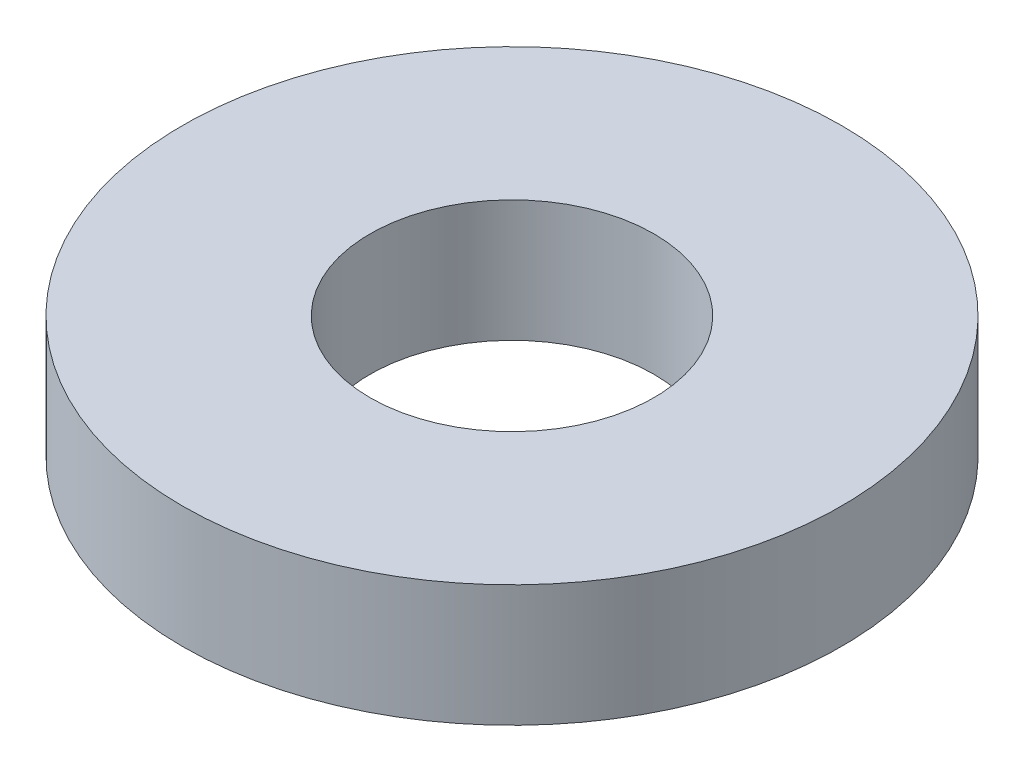
from build123d import *

# Parameters (mm, degrees)
SKETCH_1_R      = 32.5
SKETCH_1_R_2    = 14
EXTRUDE_1_DEPTH = 12


with BuildPart() as part:
    # 草图1 → 凸台-拉伸1 (new body)
    with BuildSketch(Plane(origin=(0, 0, 0), x_dir=(1, 0, 0), z_dir=(0, 1, 0))):
        with Locations(Location((0, 0, 0), (0, 0, 270))):
            Circle(SKETCH_1_R)
        with Locations(Location((0, 0, 0), (0, 0, 270))):
            Circle(SKETCH_1_R_2, mode=Mode.SUBTRACT)
    extrude(amount=EXTRUDE_1_DEPTH)


solid = part.part
